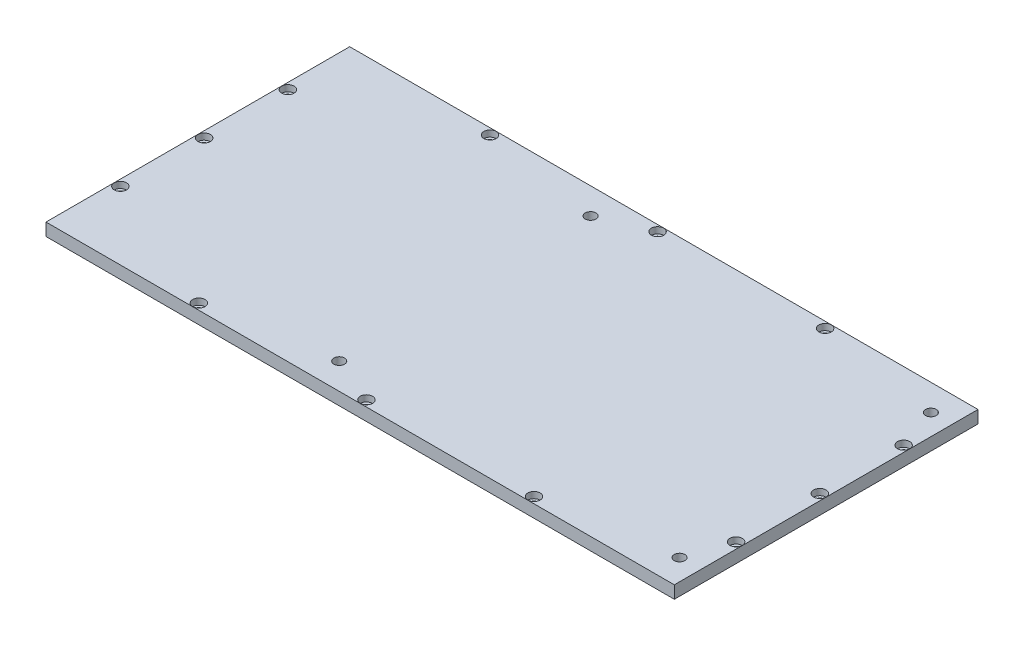
from build123d import *

# Parameters (mm, degrees)
SKETCH_1_W          = 300
SKETCH_1_H          = 145
EXTRUDE_1_DEPTH     = 60
SHELL_1_T           = -6
SKETCH_2_R          = 2.55
CUT_EXTRUDE_1_DEPTH = 176.134947969
SKETCH_3_W          = 300
SKETCH_3_H          = 145
CUT_EXTRUDE_2_DEPTH = 176.134947969
SKETCH_4_R          = 1.6
CUT_EXTRUDE_3_DEPTH = 167.71007768
SKETCH_5_R          = 2.95
CUT_EXTRUDE_5_DEPTH = 3


with BuildPart() as part:
    # ｽｹｯﾁ1 → ﾎﾞｽ - 押し出し1 (new body)
    with BuildSketch(Plane(origin=(0, 0, 0), x_dir=(1, 0, 0), z_dir=(0, 1, 0))):
        Rectangle(SKETCH_1_W, SKETCH_1_H)
    extrude(amount=EXTRUDE_1_DEPTH)

    # ｼｪﾙ1
    shell_1_openings = [part.faces().sort_by_distance(p)[0] for p in [
        (0, 60, 0),
    ]]
    offset(amount=SHELL_1_T, openings=shell_1_openings, kind=Kind.INTERSECTION)

    # ｽｹｯﾁ2 → ｶｯﾄ - 押し出し1 (cut, through all)
    with BuildSketch(Plane(origin=(0, 6, 0), x_dir=(1, 0, 0), z_dir=(0, 1, 0))):
        with Locations(Location((140, 60, 0), (0, 0, 270))):
            Circle(SKETCH_2_R)
        with Locations(Location((140, -60, 0), (0, 0, 90))):
            Circle(SKETCH_2_R)
        with Locations(Location((-22.5, -60, 0), (0, 0, 270))):
            Circle(SKETCH_2_R)
        with Locations(Location((-22.5, 60, 0), (0, 0, 90))):
            Circle(SKETCH_2_R)
    extrude(amount=-CUT_EXTRUDE_1_DEPTH, mode=Mode.SUBTRACT)

    # ｽｹｯﾁ3 → ｶｯﾄ - 押し出し2 (cut, through all)
    with BuildSketch(Plane(origin=(0, 6, 0), x_dir=(1, 0, 0), z_dir=(0, 1, 0))):
        Rectangle(SKETCH_3_W, SKETCH_3_H)
    extrude(amount=CUT_EXTRUDE_2_DEPTH, mode=Mode.SUBTRACT)

    # ｽｹｯﾁ4 → ｶｯﾄ - 押し出し3 (cut, through all)
    with BuildSketch(Plane.XZ):
        with Locations(Location((147, 0, 0), (0, 0, 270))):
            Circle(SKETCH_4_R)
        with Locations(Location((147, 40, 0), (0, 0, 270))):
            Circle(SKETCH_4_R)
        with Locations(Location((147, -40, 0), (0, 0, 90))):
            Circle(SKETCH_4_R)
        with Locations(Location((-147, -40, 0), (0, 0, 270))):
            Circle(SKETCH_4_R)
        with Locations(Location((-147, 0, 0), (0, 0, 90))):
            Circle(SKETCH_4_R)
        with Locations(Location((-147, 40, 0), (0, 0, 90))):
            Circle(SKETCH_4_R)
        with Locations(Location((0, 69.5, 0), (0, 0, 270))):
            Circle(SKETCH_4_R)
        with Locations(Location((-80, 69.5, 0), (0, 0, 270))):
            Circle(SKETCH_4_R)
        with Locations(Location((80, 69.5, 0), (0, 0, 90))):
            Circle(SKETCH_4_R)
        with Locations(Location((80, -69.5, 0), (0, 0, 270))):
            Circle(SKETCH_4_R)
        with Locations(Location((0, -69.5, 0), (0, 0, 90))):
            Circle(SKETCH_4_R)
        with Locations(Location((-80, -69.5, 0), (0, 0, 90))):
            Circle(SKETCH_4_R)
    extrude(amount=-CUT_EXTRUDE_3_DEPTH, mode=Mode.SUBTRACT)

    # ｽｹｯﾁ5 → ｶｯﾄ - 押し出し5 (cut)
    with BuildSketch(Plane(origin=(0, 6, 0), x_dir=(1, 0, 0), z_dir=(0, 1, 0))):
        with Locations(Location((147, -40, 0), (0, 0, 270))):
            Circle(SKETCH_5_R)
        with Locations(Location((147, 0, 0), (0, 0, 270))):
            Circle(SKETCH_5_R)
        with Locations(Location((147, 40, 0), (0, 0, 270))):
            Circle(SKETCH_5_R)
        with Locations(Location((80, 69.5, 0), (0, 0, 270))):
            Circle(SKETCH_5_R)
        with Locations(Location((0, 69.5, 0), (0, 0, 270))):
            Circle(SKETCH_5_R)
        with Locations(Location((-80, 69.5, 0), (0, 0, 270))):
            Circle(SKETCH_5_R)
        with Locations(Location((-147, 40, 0), (0, 0, 270))):
            Circle(SKETCH_5_R)
        with Locations(Location((-147, 0, 0), (0, 0, 270))):
            Circle(SKETCH_5_R)
        with Locations(Location((-147, -40, 0), (0, 0, 270))):
            Circle(SKETCH_5_R)
        with Locations(Location((80, -69.5, 0), (0, 0, 270))):
            Circle(SKETCH_5_R)
        with Locations(Location((0, -69.5, 0), (0, 0, 270))):
            Circle(SKETCH_5_R)
        with Locations(Location((-80, -69.5, 0), (0, 0, 270))):
            Circle(SKETCH_5_R)
    extrude(amount=-CUT_EXTRUDE_5_DEPTH, mode=Mode.SUBTRACT)


solid = part.part
